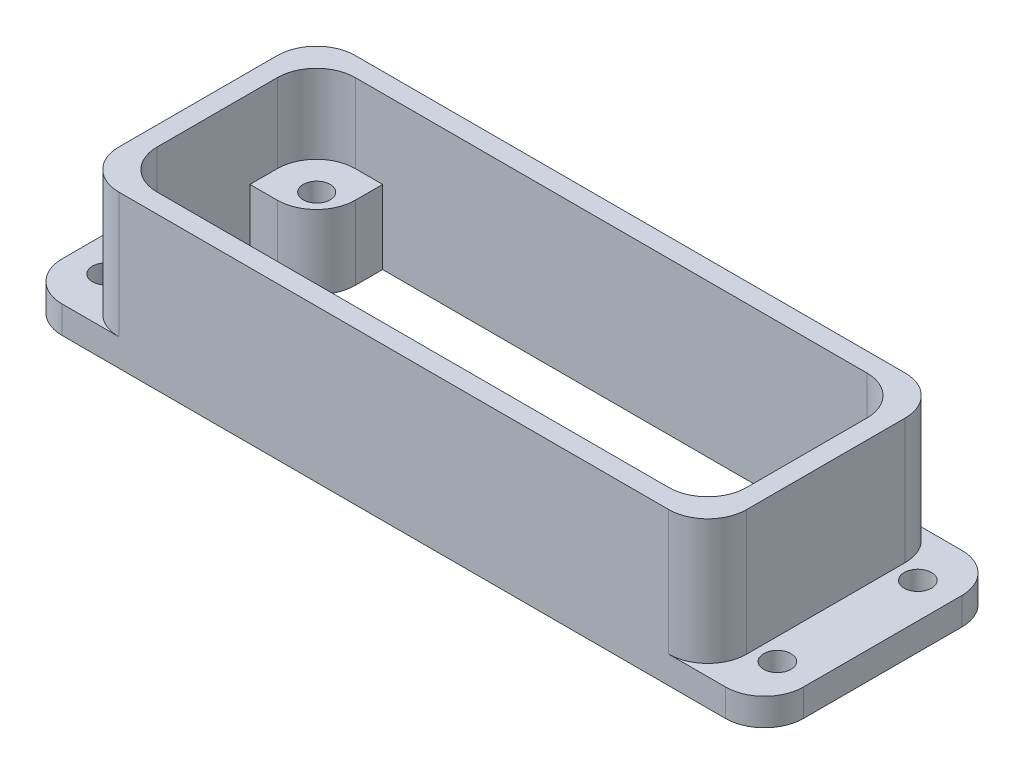
from build123d import *

# Parameters (mm, degrees)
SKETCH_1_W               = 95
SKETCH_1_H               = 30.3
EXTRUDE_1_DEPTH          = 3.5
SKETCH_2_W               = 80.45
SKETCH_2_H               = 30.3
EXTRUDE_2_DEPTH          = 16.05
FILLET_1_R               = 5
CUT_EXTRUDE_1_DEPTH      = 54.553477945
CUT_EXTRUDE_1_DEPTH_BACK = 54.553477945
CUT_EXTRUDE_2_DEPTH      = 53.377237422
CUT_EXTRUDE_2_DEPTH_BACK = 53.377237422
SKETCH_4_R               = 1.75
SKETCH_5_R               = 1.725
EXTRUDE_3_DEPTH          = 9.45
MIRROR_2_COPY_1_SKETCH_R = 1.725
MIRROR_2_COPY_1_DEPTH    = 9.45


with BuildPart() as part:
    # Эскиз1 → Бобышка-Вытянуть1 (new body)
    with BuildSketch(Plane(origin=(0, 0, 0), x_dir=(1, 0, 0), z_dir=(0, 1, 0))):
        Rectangle(SKETCH_1_W, SKETCH_1_H)
    extrude(amount=EXTRUDE_1_DEPTH)

    # Эскиз2 → Бобышка-Вытянуть2 (add)
    with BuildSketch(Plane(origin=(0, 3.5, 0), x_dir=(1, 0, 0), z_dir=(0, 1, 0))):
        Rectangle(SKETCH_2_W, SKETCH_2_H)
    extrude(amount=EXTRUDE_2_DEPTH)

    # Скругление1
    fillet_1_edges = [part.edges().sort_by_distance(p)[0] for p in [
        (40.225, 11.525, 15.15),
        (40.225, 11.525, -15.15),
        (-40.225, 11.525, -15.15),
        (-40.225, 11.525, 15.15),
        (47.5, 1.75, 15.15),
        (-47.5, 1.75, 15.15),
        (-47.5, 1.75, -15.15),
        (47.5, 1.75, -15.15),
    ]]
    fillet(fillet_1_edges, radius=FILLET_1_R)

    # Эскиз3 → Вырез-Вытянуть1 (cut, two sides: drawn at the far end of the back side and taken through both)
    with BuildSketch(Plane(origin=(0, 19.55, 0), x_dir=(1, 0, 0), z_dir=(0, 1, 0)).offset(-CUT_EXTRUDE_1_DEPTH_BACK)):
        with BuildLine():
            Line((-32.775, 12.7), (32.775, 12.7))
            ThreePointArc((32.775, 12.7), (36.310533906, 11.235533906), (37.775, 7.7))
            Line((37.775, 7.7), (37.775, -7.7))
            ThreePointArc((37.775, -7.7), (36.310533906, -11.235533906), (32.775, -12.7))
            Line((32.775, -12.7), (-32.775, -12.7))
            ThreePointArc((-32.775, -12.7), (-36.310533906, -11.235533906), (-37.775, -7.7))
            Line((-37.775, -7.7), (-37.775, 7.7))
            ThreePointArc((-37.775, 7.7), (-36.310533906, 11.235533906), (-32.775, 12.7))
        make_face()
    extrude(amount=CUT_EXTRUDE_1_DEPTH + CUT_EXTRUDE_1_DEPTH_BACK, mode=Mode.SUBTRACT)

    # Эскиз4 → Вырез-Вытянуть2 (cut, two sides: drawn at the far end of the back side and taken through both)
    with BuildSketch(Plane(origin=(0, 3.5, 0), x_dir=(1, 0, 0), z_dir=(0, 1, 0)).offset(-CUT_EXTRUDE_2_DEPTH_BACK)):
        with Locations(Location((-43, 9, 0), (0, 0, 270))):
            Circle(SKETCH_4_R)
        with Locations(Location((43, 9, 0), (0, 0, 270))):
            Circle(SKETCH_4_R)
        with Locations(Location((-43, -9, 0), (0, 0, 270))):
            Circle(SKETCH_4_R)
        with Locations(Location((43, -9, 0), (0, 0, 270))):
            Circle(SKETCH_4_R)
    extrude(amount=CUT_EXTRUDE_2_DEPTH + CUT_EXTRUDE_2_DEPTH_BACK, mode=Mode.SUBTRACT)

    # Эскиз5 → Бобышка-Вытянуть3 (add)
    with BuildSketch(Plane.XZ):
        with BuildLine():
            Line((-37.775, 7.7), (-37.775, 4.2))
            Line((-37.775, 4.2), (-34.275, 4.2))
            ThreePointArc((-34.275, 4.2), (-30.739466094, 5.664466094), (-29.275, 9.2))
            Line((-29.275, 9.2), (-29.275, 12.7))
            Line((-29.275, 12.7), (-32.775, 12.7))
            ThreePointArc((-32.775, 12.7), (-36.310533906, 11.235533906), (-37.775, 7.7))
        make_face()
        with Locations(Location((-32.641070297, 7.616996928, 0), (0, 0, 270))):
            Circle(SKETCH_5_R, mode=Mode.SUBTRACT)
    extrude_3 = extrude(amount=-EXTRUDE_3_DEPTH)

    # Зеркальное отражение1: Бобышка-Вытянуть3 across plane
    add(extrude_3.mirror(Plane.XY))

    # Зеркальное отражение2: Бобышка-Вытянуть3 across plane
    add(extrude_3.mirror(Plane(origin=(0, 0, 0), x_dir=(0, 0, 1), z_dir=(1, 0, 0))))

    # Зеркальное отражение2 copy 1 sketch → Зеркальное отражение2 copy 1 (add)
    with BuildSketch(Plane(origin=(0, 0, 0), x_dir=(-1, 0, 0), z_dir=(0, -1, 0))):
        with BuildLine():
            Line((-37.775, 7.7), (-37.775, 4.2))
            Line((-37.775, 4.2), (-34.275, 4.2))
            ThreePointArc((-34.275, 4.2), (-30.739466094, 5.664466094), (-29.275, 9.2))
            Line((-29.275, 9.2), (-29.275, 12.7))
            Line((-29.275, 12.7), (-32.775, 12.7))
            ThreePointArc((-32.775, 12.7), (-36.310533906, 11.235533906), (-37.775, 7.7))
        make_face()
        with Locations(Location((-32.641070297, 7.616996928, 0), (0, 0, 270))):
            Circle(MIRROR_2_COPY_1_SKETCH_R, mode=Mode.SUBTRACT)
    extrude(amount=-MIRROR_2_COPY_1_DEPTH)


solid = part.part
